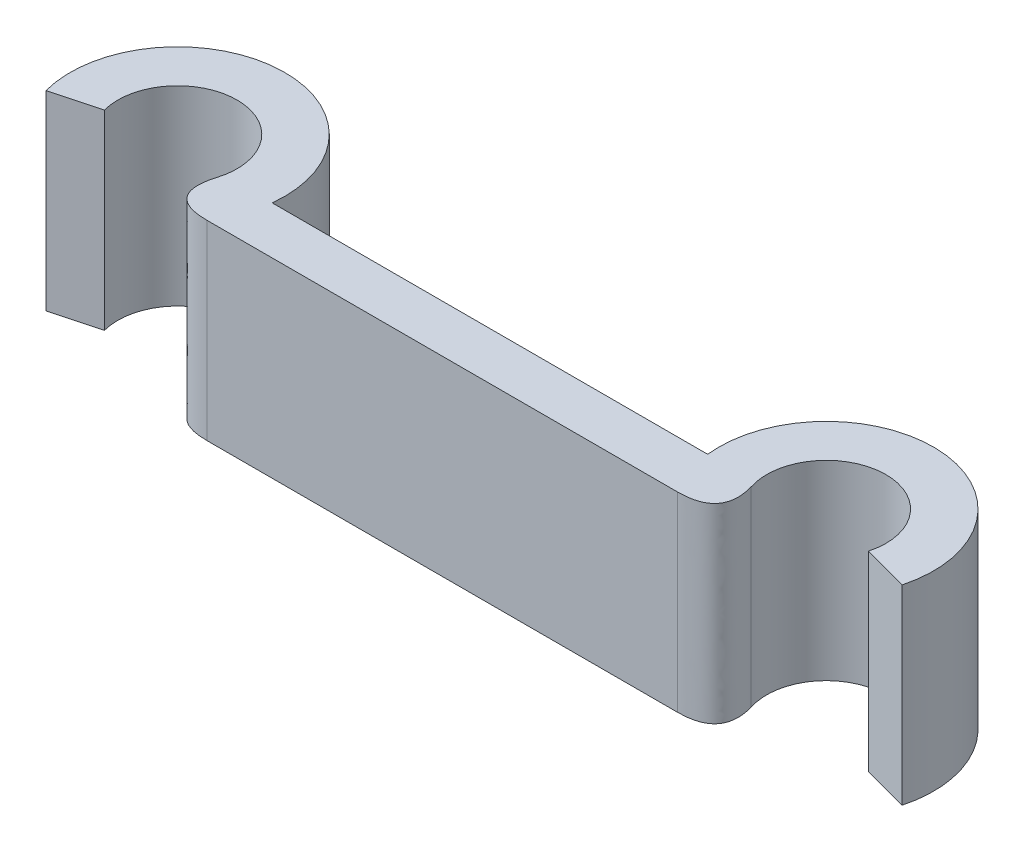
from build123d import *

# Parameters (mm, degrees)
BOSS_EXTRUDE1_DEPTH = 10


with BuildPart() as part:
    # Sketch1 → Boss-Extrude1 (new body)
    with BuildSketch(Plane(origin=(0, 0, 0), x_dir=(1, 0, 0), z_dir=(0, 1, 0))):
        with BuildLine():
            Line((-22.433332773, -1.455857129), (-20.018518207, -0.808809516))
            ThreePointArc((-20.018518207, -0.808809516), (-16.915803188, 3.123865538), (-14.029431878, -0.970231948))
            add(Edge.make_bspline(
                [(-12.322928267, -3.125), (-14.629677343, -3.130705569), (-14.029431878, -0.970231948)],
                knots=[0, 0, 0, 0.964614565, 0.964614565, 0.964614565], degree=2))
            Line((-12.322928267, -3.125), (0, -3.125))
            Line((0, -3.125), (0, -0.625))
            Line((0, -0.625), (-11.409830056, -0.625))
            ThreePointArc((-11.409830056, -0.625), (-17.422765144, 5.609090357), (-22.433332773, -1.455857129))
        make_face()
    boss_extrude1 = extrude(amount=BOSS_EXTRUDE1_DEPTH)

    # Mirror1: Boss-Extrude1 across plane
    add(boss_extrude1.mirror(Plane(origin=(0, 0, 0), x_dir=(0, 0, 1), z_dir=(1, 0, 0))))


solid = part.part
